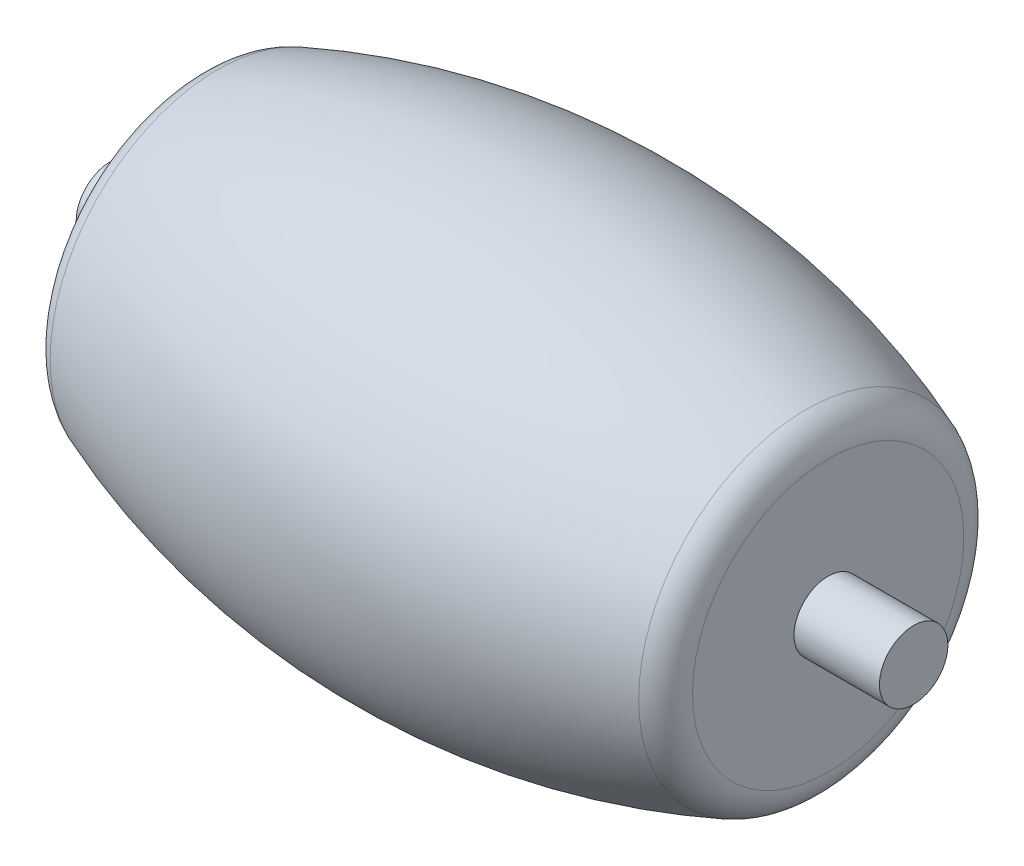
from build123d import *

# Parameters (mm, degrees)
SKETCH_2_R           = 0.75
CUT_EXTRUDE_1_DEPTH  = 31.991934593
FILLET_1_R           = 1
EXTRUDE_2_DEPTH      = 11.75
EXTRUDE_2_DEPTH_BACK = 11.75
SKETCH_4_R           = 1


with BuildPart() as part:
    # Эскиз1 → Повернуть1 (revolve)
    with BuildSketch(Plane.XY, mode=Mode.PRIVATE) as revolve_1_sk:
        with BuildLine():
            Line((-9.25, 22.145823534), (-9.25, 17.5))
            Line((-9.25, 17.5), (9.25, 17.5))
            Line((9.25, 17.5), (9.25, 22.145823534))
            ThreePointArc((9.25, 22.145823534), (0, 24), (-9.25, 22.145823534))
        make_face()
    revolve(revolve_1_sk.sketch.rotate(Axis((-9.25, 17.5, 0), (1, 0, 0)), 90), axis=Axis((-9.25, 17.5, 0), (1, 0, 0)))

    # Эскиз2 → Вырез-Вытянуть1 (cut, through all)
    with BuildSketch(Plane.ZY.offset(9.25)):
        with Locations((0, 17.5)):
            Circle(SKETCH_2_R)
    extrude(amount=-CUT_EXTRUDE_1_DEPTH, mode=Mode.SUBTRACT)

    # Скругление1
    fillet_1_edges = [part.edges().sort_by_distance(p)[0] for p in [
        (9.25, 17.5, -4.645823534),
        (-9.25, 17.5, -4.645823534),
    ]]
    fillet(fillet_1_edges, radius=FILLET_1_R)

    # Эскиз4 → Бобышка-Вытянуть2 (add, two sides: drawn at the far end of the back side and taken through both)
    with BuildSketch(Plane.ZY.offset(-EXTRUDE_2_DEPTH_BACK)):
        with Locations((0, 17.5)):
            Circle(SKETCH_4_R)
    extrude(amount=EXTRUDE_2_DEPTH + EXTRUDE_2_DEPTH_BACK)


solid = part.part
